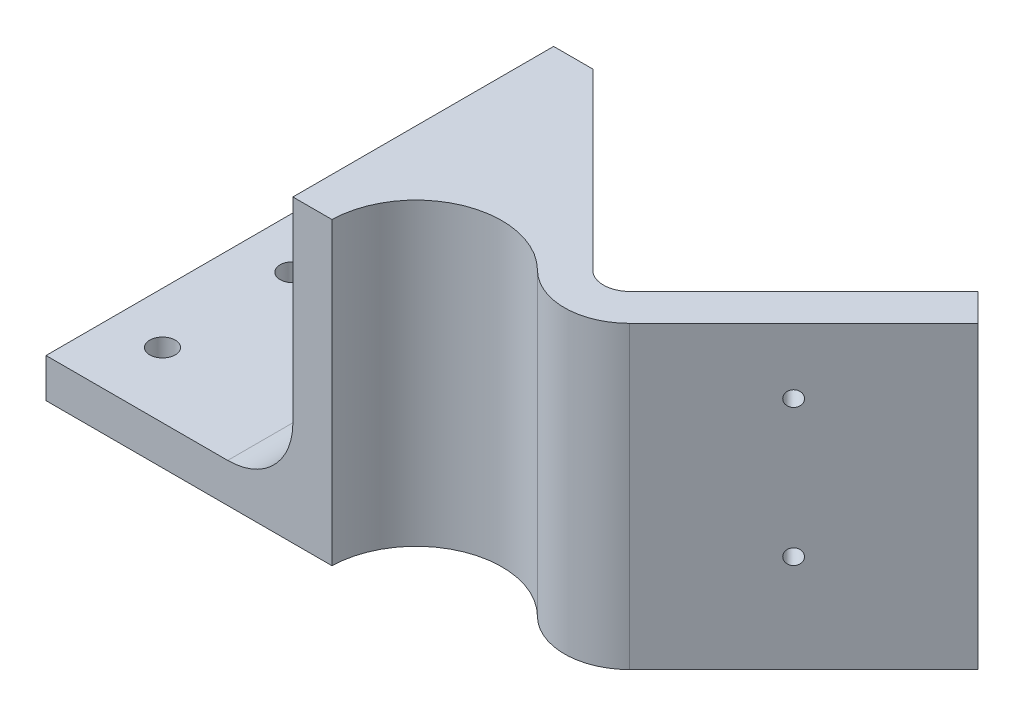
from build123d import *

# Parameters (mm, degrees)
BOSS_EXTRUDE1_DEPTH = 50.8
BOSS_EXTRUDE2_START = -7.62
SKETCH1_3_R         = 2.5
BOSS_EXTRUDE2_DEPTH = 7.62
SKETCH2_R           = 1.5
CUT_EXTRUDE1_DEPTH  = 12.7
SKETCH3_R           = 1.5
CUT_EXTRUDE2_DEPTH  = 12.7
FILLET1_R           = 12.7


with BuildPart() as part:
    # Sketch1 → Boss-Extrude1 (new body)
    with BuildSketch(Plane(origin=(0, 0, 0), x_dir=(1, 0, 0), z_dir=(0, 1, 0))):
        with BuildLine():
            Line((20.559796753, 13.375591856), (3.592102448, -3.592102448))
            ThreePointArc((3.592102448, -3.592102448), (0, -5.08), (-3.592102448, -3.592102448))
            Line((-3.592102448, -3.592102448), (-20.559796753, 13.375591856))
            Line((-20.559796753, 13.375591856), (-37.527491057, 30.34328616))
            Line((-37.527491057, 30.34328616), (-45.147491057, 30.34328616))
            Line((-45.147491057, 30.34328616), (-45.147491057, -20.45671384))
            Line((-45.147491057, -20.45671384), (-37.527491057, -20.45671384))
            ThreePointArc((-37.527491057, -20.45671384), (-27.044794722, -5.28871851), (-8.980256121, -8.980256121))
            ThreePointArc((-8.980256121, -8.980256121), (0, -12.7), (8.980256121, -8.980256121))
            Line((8.980256121, -8.980256121), (42.915644729, 24.955132487))
            Line((42.915644729, 24.955132487), (37.527491057, 30.34328616))
            Line((37.527491057, 30.34328616), (20.559796753, 13.375591856))
        make_face()
    extrude(amount=BOSS_EXTRUDE1_DEPTH)

    # Sketch1<3> → Boss-Extrude2 (add)
    with BuildSketch(Plane(origin=(0, 0, 0), x_dir=(1, 0, 0), z_dir=(0, 1, 0)).offset(BOSS_EXTRUDE2_START)):
        with BuildLine():
            Line((20.559796753, 13.375591856), (-20.559796753, 13.375591856))
            Line((-20.559796753, 13.375591856), (-37.527491057, 30.34328616))
            Line((-37.527491057, 30.34328616), (-93.247491057, 30.34328616))
            Line((-93.247491057, 30.34328616), (-93.247491057, -20.45671384))
            Line((-93.247491057, -20.45671384), (-37.527491057, -20.45671384))
            ThreePointArc((-37.527491057, -20.45671384), (-27.044794722, -5.28871851), (-8.980256121, -8.980256121))
            ThreePointArc((-8.980256121, -8.980256121), (0, -12.7), (8.980256121, -8.980256121))
            Line((8.980256121, -8.980256121), (42.915644729, 24.955132487))
            Line((42.915644729, 24.955132487), (37.527491057, 30.34328616))
            Line((37.527491057, 30.34328616), (20.559796753, 13.375591856))
        make_face()
        with Locations((-83.247491057, 17.64328616)):
            Circle(SKETCH1_3_R, mode=Mode.SUBTRACT)
        with Locations((-83.247491057, -7.75671384)):
            Circle(SKETCH1_3_R, mode=Mode.SUBTRACT)
    extrude(amount=BOSS_EXTRUDE2_DEPTH)

    # Sketch2 → Cut-Extrude1 (cut)
    with BuildSketch(Plane(origin=(-3.592102448, 0, 3.592102448), x_dir=(-0.7071067811865488, 0, -0.7071067811865464), z_dir=(0.7071067811865464, 0, -0.7071067811865488))):
        with Locations((22.591886814, 38.1)):
            Circle(SKETCH2_R)
        with Locations((22.591886814, 11.43)):
            Circle(SKETCH2_R)
    extrude(amount=-CUT_EXTRUDE1_DEPTH, mode=Mode.SUBTRACT)

    # Sketch3 → Cut-Extrude2 (cut)
    with BuildSketch(Plane(origin=(3.592102448, 0, 3.592102448), x_dir=(-0.7071067811865488, 0, 0.7071067811865464), z_dir=(-0.7071067811865464, 0, -0.7071067811865488))):
        with Locations((-22.591886814, 38.1)):
            Circle(SKETCH3_R)
        with Locations((-22.591886814, 11.43)):
            Circle(SKETCH3_R)
    extrude(amount=-CUT_EXTRUDE2_DEPTH, mode=Mode.SUBTRACT)

    # Fillet1
    fillet1_edges = [part.edges().sort_by_distance(p)[0] for p in [
        (-45.147491057, 0, -4.94328616),
    ]]
    fillet(fillet1_edges, radius=FILLET1_R)


solid = part.part
